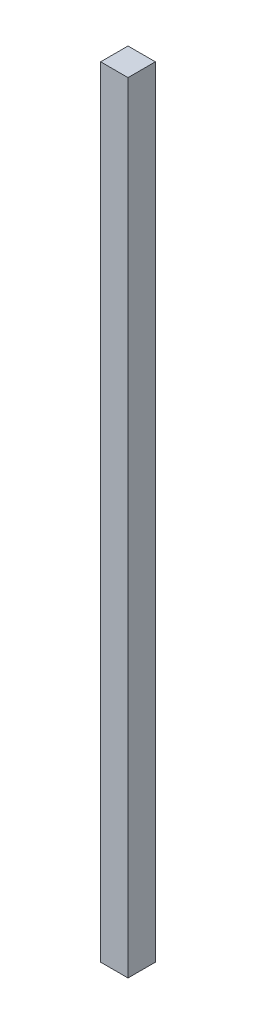
from build123d import *

# Parameters (mm, degrees)
SKETCH_1_W          = 50
SKETCH_1_H          = 50
EXTRUDE_1_DEPTH     = 1425
SKETCH_2_R          = 5
CUT_EXTRUDE_1_DEPTH = 50


with BuildPart() as part:
    # Эскиз1 → Бобышка-Вытянуть1 (new body)
    with BuildSketch(Plane(origin=(0, 0, 0), x_dir=(1, 0, 0), z_dir=(0, 1, 0))):
        Rectangle(SKETCH_1_W, SKETCH_1_H)
    extrude(amount=EXTRUDE_1_DEPTH)

    # Эскиз2 → Вырез-Вытянуть1 (cut)
    with BuildSketch(Plane.XZ):
        with Locations(Location((0, 0, 0), (0, 0, 270))):
            Circle(SKETCH_2_R)
    extrude(amount=-CUT_EXTRUDE_1_DEPTH, mode=Mode.SUBTRACT)


solid = part.part
